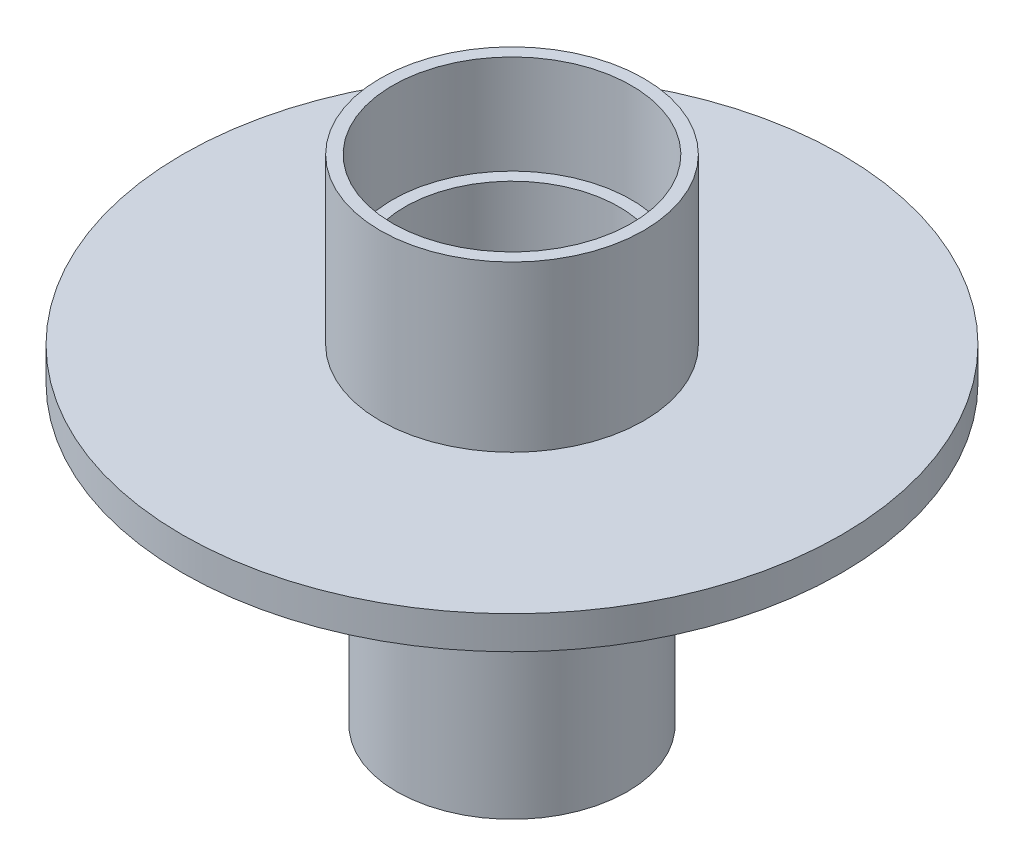
from build123d import *


with BuildPart() as part:
    # Sketch1 → Revolve1 (revolve)
    with BuildSketch(Plane(origin=(0, 0, 0), x_dir=(0, 0, -1), z_dir=(1, 0, 0))):
        Polygon((-16, 3.37389395), (-40, 3.37389395), (-40, -0.62610605), (-14.5, -0.62610605), (-14, -0.62610605), (-14, -36.62610605), (-13, -36.62610605), (-13, -0.62610605), (-13, 11.37389395), (-14.5, 11.37389395), (-14.5, 23.37389395), (-16, 23.37389395), align=None)
    revolve(axis=Axis((0, 28.058626224, 0), (0, -1, 0)))


solid = part.part
